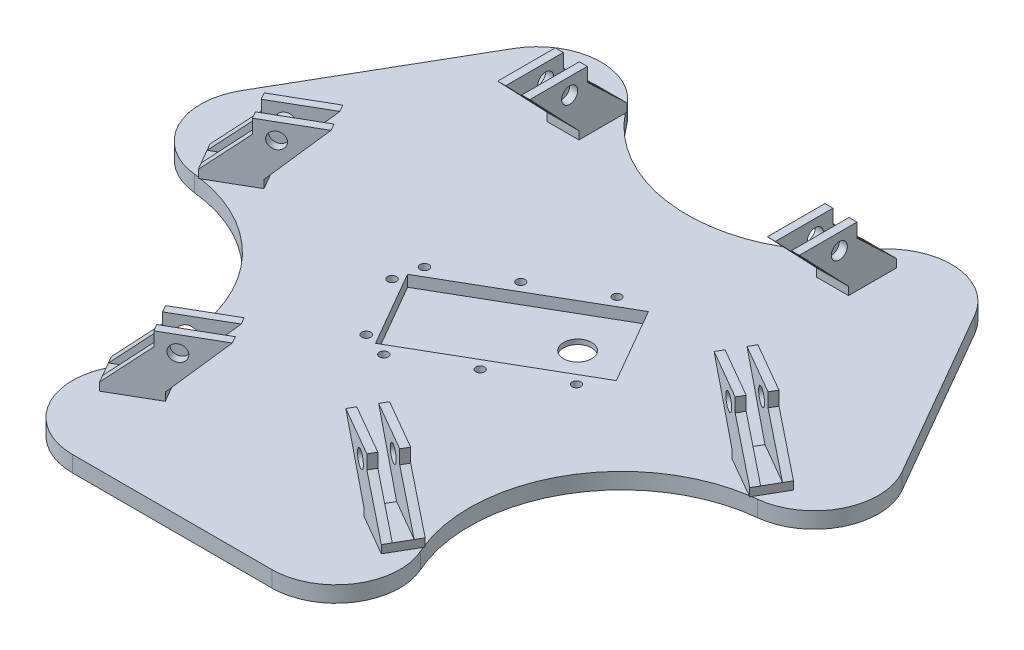
from build123d import *

# Parameters (mm, degrees)
BOSS_EXTRUDE1_DEPTH      = 5
BOSS_EXTRUDE11_DEPTH     = 2.5
BOSS_EXTRUDE12_DEPTH     = 2.5
SKETCH29_R               = 2.5
CUT_EXTRUDE1_DEPTH       = 204.243080392
MIRROR5_COPY_1_DEPTH     = 2.5
MIRROR5_COPY_2_SKETCH_R  = 2.5
MIRROR5_COPY_2_DEPTH     = 204.243080392
MIRROR6_COPY_1_DEPTH     = 2.5
MIRROR6_COPY_2_SKETCH_R  = 2.5
MIRROR6_COPY_2_DEPTH     = 204.243080392
MIRROR6_COPY_3_SKETCH_R  = 2.5
MIRROR6_COPY_3_DEPTH     = 204.243080392
MIRROR6_COPY_4_DEPTH     = 2.5
MIRROR6_COPY_5_DEPTH     = 2.5
MIRROR6_COPY_6_SKETCH_R  = 2.5
MIRROR6_COPY_6_DEPTH     = 204.243080392
MIRROR6_COPY_7_DEPTH     = 2.5
MIRROR6_COPY_8_SKETCH_R  = 2.5
MIRROR6_COPY_8_DEPTH     = 204.243080392
MIRROR6_COPY_9_SKETCH_R  = 2.5
MIRROR6_COPY_9_DEPTH     = 204.243080392
MIRROR7_COPY_1_DEPTH     = 2.5
MIRROR7_COPY_2_SKETCH_R  = 2.5
MIRROR7_COPY_2_DEPTH     = 204.243080392
MIRROR7_COPY_3_DEPTH     = 2.5
MIRROR7_COPY_4_SKETCH_R  = 2.5
MIRROR7_COPY_4_DEPTH     = 204.243080392
MIRROR7_COPY_5_DEPTH     = 2.5
MIRROR7_COPY_6_DEPTH     = 2.5
MIRROR7_COPY_7_SKETCH_R  = 2.5
MIRROR7_COPY_7_DEPTH     = 204.243080392
MIRROR7_COPY_8_DEPTH     = 2.5
MIRROR7_COPY_9_SKETCH_R  = 2.5
MIRROR7_COPY_9_DEPTH     = 204.243080392
MIRROR7_COPY_10_DEPTH    = 2.5
MIRROR7_COPY_11_DEPTH    = 2.5
MIRROR7_COPY_12_SKETCH_R = 2.5
MIRROR7_COPY_12_DEPTH    = 204.243080392
MIRROR7_COPY_13_DEPTH    = 2.5
MIRROR7_COPY_14_DEPTH    = 2.5
MIRROR7_COPY_15_DEPTH    = 2.5
MIRROR7_COPY_16_SKETCH_R = 2.5
MIRROR7_COPY_16_DEPTH    = 204.243080392
MIRROR7_COPY_17_SKETCH_R = 2.5
MIRROR7_COPY_17_DEPTH    = 204.243080392
MIRROR7_COPY_18_DEPTH    = 2.5
MIRROR7_COPY_19_DEPTH    = 2.5
MIRROR7_COPY_20_SKETCH_R = 2.5
MIRROR7_COPY_20_DEPTH    = 204.243080392
MIRROR7_COPY_21_DEPTH    = 2.5
MIRROR7_COPY_22_SKETCH_R = 2.5
MIRROR7_COPY_22_DEPTH    = 204.243080392
MIRROR7_COPY_23_SKETCH_R = 2.5
MIRROR7_COPY_23_DEPTH    = 204.243080392
MIRROR7_COPY_24_DEPTH    = 2.5
MIRROR7_COPY_25_DEPTH    = 2.5
MIRROR7_COPY_26_SKETCH_R = 2.5
MIRROR7_COPY_26_DEPTH    = 204.243080392
CUT_EXTRUDE2_DEPTH       = 3.5
SKETCH31_R               = 4.4
CUT_EXTRUDE3_DEPTH       = 218.222961533
SKETCH33_R               = 1.35
SKETCH33_R_2             = 1.385
CUT_EXTRUDE4_DEPTH       = 217.895493722


with BuildPart() as part:
    # Sketch1 → Boss-Extrude1 (new body)
    with BuildSketch(Plane(origin=(0, 0, 0), x_dir=(1, 0, 0), z_dir=(0, 1, 0))):
        with BuildLine():
            Line((-71.958276695, 178.473500064), (-103.041723305, 124.63539126))
            ThreePointArc((-103.041723305, 124.63539126), (-103.538010574, 105.549038655), (-87.797177129, 94.743423479))
            ThreePointArc((-87.797177129, 94.743423479), (-51.591379961, 71.25), (-49.34837699, 28.148148148))
            ThreePointArc((-49.34837699, 28.148148148), (-47.860856467, 9.113378921), (-31.083446611, 0))
            Line((-31.083446611, 0), (31.083446611, 0))
            ThreePointArc((31.083446611, 0), (47.860856467, 9.113378921), (49.34837699, 28.148148148))
            ThreePointArc((49.34837699, 28.148148148), (51.591379961, 71.25), (87.797177129, 94.743423479))
            ThreePointArc((87.797177129, 94.743423479), (103.538010574, 105.549038655), (103.041723305, 124.63539126))
            Line((103.041723305, 124.63539126), (71.958276695, 178.473500064))
            ThreePointArc((71.958276695, 178.473500064), (55.677154107, 188.446473749), (38.448800139, 180.217319697))
            ThreePointArc((38.448800139, 180.217319697), (0, 160.608891325), (-38.448800139, 180.217319697))
            ThreePointArc((-38.448800139, 180.217319697), (-55.677154107, 188.446473749), (-71.958276695, 178.473500064))
        make_face()
    extrude(amount=BOSS_EXTRUDE1_DEPTH)

    # Sketch27 → Boss-Extrude11 (add)
    with BuildSketch(Plane(origin=(0, 5, 0), x_dir=(1, 0, 0), z_dir=(0, 1, 0))):
        Polygon((-91.006862425, 102.829137181), (-86.006862425, 94.168883143), (-73.016481368, 101.668883143), (-78.016481368, 110.329137181), align=None)
    boss_extrude11 = extrude(amount=BOSS_EXTRUDE11_DEPTH)

    # Sketch28 → Boss-Extrude12 (add)
    with BuildSketch(Plane(origin=(-62.27803813, 0, -107.868726237), x_dir=(0.8660254037844392, 0, -0.4999999999999992), z_dir=(0.4999999999999992, 0, 0.8660254037844392))):
        Polygon((-27.399686188, 7.5), (-15.026700929, 19.217361527), (-15.026700929, 23.558545761), (2.927379132, 23.558545761), (-12.399686188, 7.5), align=None)
    boss_extrude12 = extrude(amount=-BOSS_EXTRUDE12_DEPTH)

    # Sketch29 → Cut-Extrude1 (cut, symmetric)
    with BuildSketch(Plane(origin=(-63.52803813, 0, -110.033789746), x_dir=(-0.8660254037844393, 0, 0.49999999999999895), z_dir=(-0.49999999999999895, 0, -0.8660254037844393))):
        with Locations((9.526700929, 18.558545761)):
            Circle(SKETCH29_R)
    cut_extrude1 = extrude(amount=CUT_EXTRUDE1_DEPTH, both=True, mode=Mode.SUBTRACT)

    # Mirror4: Boss-Extrude12, Cut-Extrude1 across plane
    add(boss_extrude12.mirror(Plane(origin=(-64.77803813, 0, -112.198853256), x_dir=(-0.8660254037844388, 0, 0.49999999999999967), z_dir=(0.49999999999999967, 0, 0.8660254037844388))))
    add(cut_extrude1.mirror(Plane(origin=(-64.77803813, 0, -112.198853256), x_dir=(-0.8660254037844388, 0, 0.49999999999999967), z_dir=(0.49999999999999967, 0, 0.8660254037844388))), mode=Mode.SUBTRACT)

    # Mirror5: Boss-Extrude11, Boss-Extrude12, Cut-Extrude1 across plane
    add(boss_extrude11.mirror(Plane(origin=(-43.75, 0, -75.777222831), x_dir=(-0.8660254037844389, 0, 0.4999999999999998), z_dir=(0.5000000000000001, 0, 0.8660254037844387))))
    add(boss_extrude12.mirror(Plane(origin=(-43.75, 0, -75.777222831), x_dir=(-0.8660254037844389, 0, 0.4999999999999998), z_dir=(0.5000000000000001, 0, 0.8660254037844387))))
    add(cut_extrude1.mirror(Plane(origin=(-43.75, 0, -75.777222831), x_dir=(-0.8660254037844389, 0, 0.4999999999999998), z_dir=(0.5000000000000001, 0, 0.8660254037844387))), mode=Mode.SUBTRACT)

    # Mirror5 copy 1 sketch → Mirror5 copy 1 (add)
    with BuildSketch(Plane(origin=(-20.22196187, 0, -35.025465388), x_dir=(0.8660254037844386, 0, -0.5000000000000001), z_dir=(0.5000000000000001, 0, 0.8660254037844392))):
        Polygon((-27.399686188, 7.5), (-15.026700929, 19.217361527), (-15.026700929, 23.558545761), (2.927379132, 23.558545761), (-12.399686188, 7.5), align=None)
    extrude(amount=-MIRROR5_COPY_1_DEPTH)

    # Mirror5 copy 2 sketch → Mirror5 copy 2 (cut, symmetric)
    with BuildSketch(Plane(origin=(-21.47196187, 0, -37.190528897), x_dir=(-0.8660254037844387, 0, 0.4999999999999998), z_dir=(-0.49999999999999983, 0, -0.8660254037844393))):
        with Locations((9.526700929, 18.558545761)):
            Circle(MIRROR5_COPY_2_SKETCH_R)
    extrude(amount=MIRROR5_COPY_2_DEPTH, both=True, mode=Mode.SUBTRACT)

    # Mirror6: Boss-Extrude11, Boss-Extrude12 across plane
    add(boss_extrude11.mirror(Plane(origin=(0, 0, 0), x_dir=(0, 0, 1), z_dir=(1, 0, 0))))
    add(boss_extrude12.mirror(Plane(origin=(0, 0, 0), x_dir=(0, 0, 1), z_dir=(1, 0, 0))))

    # Mirror6 copy 1 sketch → Mirror6 copy 1 (add)
    with BuildSketch(Plane(origin=(67.27803813, 0, -116.528980275), x_dir=(-0.8660254037844386, 0, -0.5000000000000002), z_dir=(0.5000000000000002, 0, -0.8660254037844386))):
        Polygon((-27.399686188, 7.5), (-15.026700929, 19.217361527), (-15.026700929, 23.558545761), (2.927379132, 23.558545761), (-12.399686188, 7.5), align=None)
    extrude(amount=-MIRROR6_COPY_1_DEPTH)

    # Mirror6 copy 2 sketch → Mirror6 copy 2 (cut, symmetric)
    with BuildSketch(Plane(origin=(66.02803813, 0, -114.363916765), x_dir=(0.8660254037844384, 0, 0.5000000000000004), z_dir=(-0.5000000000000004, 0, 0.8660254037844384))):
        with Locations((9.526700929, 18.558545761)):
            Circle(MIRROR6_COPY_2_SKETCH_R)
    extrude(amount=MIRROR6_COPY_2_DEPTH, both=True, mode=Mode.SUBTRACT)

    # Mirror6 copy 3 sketch → Mirror6 copy 3 (cut, symmetric)
    with BuildSketch(Plane(origin=(63.52803813, 0, -110.033789746), x_dir=(0.8660254037844393, 0, 0.49999999999999895), z_dir=(0.49999999999999895, 0, -0.8660254037844393))):
        with Locations((9.526700929, -18.558545761)):
            Circle(MIRROR6_COPY_3_SKETCH_R)
    extrude(amount=MIRROR6_COPY_3_DEPTH, both=True, mode=Mode.SUBTRACT)

    # Mirror6 copy 4 sketch → Mirror6 copy 4 (add)
    with BuildSketch(Plane(origin=(87.5, 5, -151.554445662), x_dir=(-0.4999999999999998, 0, -0.8660254037844389), z_dir=(0, 1, 0))):
        Polygon((-91.006862425, 102.829137181), (-86.006862425, 94.168883143), (-73.016481368, 101.668883143), (-78.016481368, 110.329137181), align=None)
    extrude(amount=MIRROR6_COPY_4_DEPTH)

    # Mirror6 copy 5 sketch → Mirror6 copy 5 (add)
    with BuildSketch(Plane(origin=(25.22196187, 0, -43.685719425), x_dir=(-0.8660254037844382, 0, -0.5000000000000009), z_dir=(0.5000000000000011, 0, -0.8660254037844386))):
        Polygon((-27.399686188, 7.5), (-15.026700929, 19.217361527), (-15.026700929, 23.558545761), (2.927379132, 23.558545761), (-12.399686188, 7.5), align=None)
    extrude(amount=-MIRROR6_COPY_5_DEPTH)

    # Mirror6 copy 6 sketch → Mirror6 copy 6 (cut, symmetric)
    with BuildSketch(Plane(origin=(23.97196187, 0, -41.520655916), x_dir=(0.866025403784438, 0, 0.5000000000000012), z_dir=(-0.5000000000000014, 0, 0.8660254037844384))):
        with Locations((9.526700929, 18.558545761)):
            Circle(MIRROR6_COPY_6_SKETCH_R)
    extrude(amount=MIRROR6_COPY_6_DEPTH, both=True, mode=Mode.SUBTRACT)

    # Mirror6 copy 7 sketch → Mirror6 copy 7 (add)
    with BuildSketch(Plane(origin=(20.22196187, 0, -35.025465388), x_dir=(-0.8660254037844386, 0, -0.5000000000000001), z_dir=(-0.5000000000000001, 0, 0.8660254037844392))):
        Polygon((-27.399686188, -7.5), (-15.026700929, -19.217361527), (-15.026700929, -23.558545761), (2.927379132, -23.558545761), (-12.399686188, -7.5), align=None)
    extrude(amount=-MIRROR6_COPY_7_DEPTH)

    # Mirror6 copy 8 sketch → Mirror6 copy 8 (cut, symmetric)
    with BuildSketch(Plane(origin=(21.47196187, 0, -37.190528897), x_dir=(0.8660254037844387, 0, 0.4999999999999998), z_dir=(0.49999999999999983, 0, -0.8660254037844393))):
        with Locations((9.526700929, -18.558545761)):
            Circle(MIRROR6_COPY_8_SKETCH_R)
    extrude(amount=MIRROR6_COPY_8_DEPTH, both=True, mode=Mode.SUBTRACT)

    # Mirror6 copy 9 sketch → Mirror6 copy 9 (cut, symmetric)
    with BuildSketch(Plane(origin=(63.52803813, 0, -110.033789746), x_dir=(0.8660254037844393, 0, 0.49999999999999895), z_dir=(0.49999999999999895, 0, -0.8660254037844393))):
        with Locations((9.526700929, -18.558545761)):
            Circle(MIRROR6_COPY_9_SKETCH_R)
    extrude(amount=MIRROR6_COPY_9_DEPTH, both=True, mode=Mode.SUBTRACT)

    # Mirror7 copy 1 sketch → Mirror7 copy 1 (add)
    with BuildSketch(Plane(origin=(-20.22196187, 0, -35.025465388), x_dir=(0.8660254037844386, 0, -0.5000000000000001), z_dir=(0.5000000000000001, 0, 0.8660254037844392))):
        Polygon((-27.399686188, 7.5), (-15.026700929, 19.217361527), (-15.026700929, 23.558545761), (2.927379132, 23.558545761), (-12.399686188, 7.5), align=None)
    extrude(amount=-MIRROR7_COPY_1_DEPTH)

    # Mirror7 copy 2 sketch → Mirror7 copy 2 (cut, symmetric)
    with BuildSketch(Plane(origin=(-21.47196187, 0, -37.190528897), x_dir=(-0.8660254037844387, 0, 0.4999999999999998), z_dir=(-0.49999999999999983, 0, -0.8660254037844393))):
        with Locations((9.526700929, 18.558545761)):
            Circle(MIRROR7_COPY_2_SKETCH_R)
    extrude(amount=MIRROR7_COPY_2_DEPTH, both=True, mode=Mode.SUBTRACT)

    # Mirror7 copy 3 sketch → Mirror7 copy 3 (add)
    with BuildSketch(Plane(origin=(-25.22196187, 0, -43.685719425), x_dir=(0.8660254037844382, 0, -0.5000000000000009), z_dir=(-0.5000000000000011, 0, -0.8660254037844386))):
        Polygon((-27.399686188, -7.5), (-15.026700929, -19.217361527), (-15.026700929, -23.558545761), (2.927379132, -23.558545761), (-12.399686188, -7.5), align=None)
    extrude(amount=-MIRROR7_COPY_3_DEPTH)

    # Mirror7 copy 4 sketch → Mirror7 copy 4 (cut, symmetric)
    with BuildSketch(Plane(origin=(-23.97196187, 0, -41.520655916), x_dir=(-0.866025403784438, 0, 0.5000000000000012), z_dir=(0.5000000000000014, 0, 0.8660254037844384))):
        with Locations((9.526700929, -18.558545761)):
            Circle(MIRROR7_COPY_4_SKETCH_R)
    extrude(amount=MIRROR7_COPY_4_DEPTH, both=True, mode=Mode.SUBTRACT)

    # Mirror7 copy 5 sketch → Mirror7 copy 5 (add)
    with BuildSketch(Plane(origin=(0, 5, 0), x_dir=(1, 0, 0), z_dir=(0, 1, 0))):
        Polygon((-91.006862425, 102.829137181), (-86.006862425, 94.168883143), (-73.016481368, 101.668883143), (-78.016481368, 110.329137181), align=None)
    extrude(amount=MIRROR7_COPY_5_DEPTH)

    # Mirror7 copy 6 sketch → Mirror7 copy 6 (add)
    with BuildSketch(Plane(origin=(-62.27803813, 0, -107.868726237), x_dir=(0.8660254037844393, 0, -0.4999999999999993), z_dir=(0.4999999999999996, 0, 0.8660254037844398))):
        Polygon((-27.399686188, 7.5), (-15.026700929, 19.217361527), (-15.026700929, 23.558545761), (2.927379132, 23.558545761), (-12.399686188, 7.5), align=None)
    extrude(amount=-MIRROR7_COPY_6_DEPTH)

    # Mirror7 copy 7 sketch → Mirror7 copy 7 (cut, symmetric)
    with BuildSketch(Plane(origin=(-63.52803813, 0, -110.033789746), x_dir=(-0.8660254037844394, 0, 0.499999999999999), z_dir=(-0.49999999999999933, 0, -0.8660254037844399))):
        with Locations((9.526700929, 18.558545761)):
            Circle(MIRROR7_COPY_7_SKETCH_R)
    extrude(amount=MIRROR7_COPY_7_DEPTH, both=True, mode=Mode.SUBTRACT)

    # Mirror7 copy 8 sketch → Mirror7 copy 8 (add)
    with BuildSketch(Plane(origin=(-67.27803813, 0, -116.528980275), x_dir=(0.8660254037844386, 0, -0.5000000000000002), z_dir=(-0.5000000000000007, 0, -0.8660254037844394))):
        Polygon((-27.399686188, -7.5), (-15.026700929, -19.217361527), (-15.026700929, -23.558545761), (2.927379132, -23.558545761), (-12.399686188, -7.5), align=None)
    extrude(amount=-MIRROR7_COPY_8_DEPTH)

    # Mirror7 copy 9 sketch → Mirror7 copy 9 (cut, symmetric)
    with BuildSketch(Plane(origin=(-66.02803813, 0, -114.363916765), x_dir=(-0.8660254037844385, 0, 0.5000000000000003), z_dir=(0.5000000000000009, 0, 0.8660254037844393))):
        with Locations((9.526700929, -18.558545761)):
            Circle(MIRROR7_COPY_9_SKETCH_R)
    extrude(amount=MIRROR7_COPY_9_DEPTH, both=True, mode=Mode.SUBTRACT)

    # Mirror7 copy 10 sketch → Mirror7 copy 10 (add)
    with BuildSketch(Plane(origin=(-87.5, 5, -151.554445662), x_dir=(0.4999999999999998, 0, -0.8660254037844389), z_dir=(0, 1, 0))):
        Polygon((-91.006862425, -102.829137181), (-86.006862425, -94.168883143), (-73.016481368, -101.668883143), (-78.016481368, -110.329137181), align=None)
    extrude(amount=MIRROR7_COPY_10_DEPTH)

    # Mirror7 copy 11 sketch → Mirror7 copy 11 (add)
    with BuildSketch(Plane(origin=(-25.22196187, 0, -43.685719425), x_dir=(0.8660254037844382, 0, -0.5000000000000009), z_dir=(-0.5000000000000011, 0, -0.8660254037844386))):
        Polygon((-27.399686188, -7.5), (-15.026700929, -19.217361527), (-15.026700929, -23.558545761), (2.927379132, -23.558545761), (-12.399686188, -7.5), align=None)
    extrude(amount=-MIRROR7_COPY_11_DEPTH)

    # Mirror7 copy 12 sketch → Mirror7 copy 12 (cut, symmetric)
    with BuildSketch(Plane(origin=(-23.97196187, 0, -41.520655916), x_dir=(-0.866025403784438, 0, 0.5000000000000012), z_dir=(0.5000000000000014, 0, 0.8660254037844384))):
        with Locations((9.526700929, -18.558545761)):
            Circle(MIRROR7_COPY_12_SKETCH_R)
    extrude(amount=MIRROR7_COPY_12_DEPTH, both=True, mode=Mode.SUBTRACT)

    # Mirror7 copy 13 sketch → Mirror7 copy 13 (add)
    with BuildSketch(Plane(origin=(-87.5, 5, -151.554445662), x_dir=(-0.4999999999999998, 0, 0.8660254037844389), z_dir=(0, 1, 0))):
        Polygon((-91.006862425, 102.829137181), (-86.006862425, 94.168883143), (-73.016481368, 101.668883143), (-78.016481368, 110.329137181), align=None)
    extrude(amount=MIRROR7_COPY_13_DEPTH)

    # Mirror7 copy 14 sketch → Mirror7 copy 14 (add)
    with BuildSketch(Plane(origin=(37.05607626, 0, -151.554445662), x_dir=(0, 0, 1), z_dir=(-1, 0, 0))):
        Polygon((-27.399686188, 7.5), (-15.026700929, 19.217361527), (-15.026700929, 23.558545761), (2.927379132, 23.558545761), (-12.399686188, 7.5), align=None)
    extrude(amount=-MIRROR7_COPY_14_DEPTH)

    # Mirror7 copy 15 sketch → Mirror7 copy 15 (add)
    with BuildSketch(Plane(origin=(47.05607626, 0, -151.554445662), x_dir=(0, 0, 1), z_dir=(1, 0, 0))):
        Polygon((-27.399686188, -7.5), (-15.026700929, -19.217361527), (-15.026700929, -23.558545761), (2.927379132, -23.558545761), (-12.399686188, -7.5), align=None)
    extrude(amount=-MIRROR7_COPY_15_DEPTH)

    # Mirror7 copy 16 sketch → Mirror7 copy 16 (cut, symmetric)
    with BuildSketch(Plane(origin=(44.55607626, 0, -151.554445662), x_dir=(0, 0, -1), z_dir=(-1, 0, 0))):
        with Locations((9.526700929, -18.558545761)):
            Circle(MIRROR7_COPY_16_SKETCH_R)
    extrude(amount=MIRROR7_COPY_16_DEPTH, both=True, mode=Mode.SUBTRACT)

    # Mirror7 copy 17 sketch → Mirror7 copy 17 (cut, symmetric)
    with BuildSketch(Plane(origin=(39.55607626, 0, -151.554445662), x_dir=(0, 0, -1), z_dir=(1, 0, 0))):
        with Locations((9.526700929, 18.558545761)):
            Circle(MIRROR7_COPY_17_SKETCH_R)
    extrude(amount=MIRROR7_COPY_17_DEPTH, both=True, mode=Mode.SUBTRACT)

    # Mirror7 copy 18 sketch → Mirror7 copy 18 (add)
    with BuildSketch(Plane(origin=(87.5, 5, -151.554445662), x_dir=(0.5000000000000007, 0, 0.8660254037844389), z_dir=(0, 1, 0))):
        Polygon((-91.006862425, -102.829137181), (-86.006862425, -94.168883143), (-73.016481368, -101.668883143), (-78.016481368, -110.329137181), align=None)
    extrude(amount=MIRROR7_COPY_18_DEPTH)

    # Mirror7 copy 19 sketch → Mirror7 copy 19 (add)
    with BuildSketch(Plane(origin=(-37.05607626, 0, -151.554445662), x_dir=(0, 0, 1), z_dir=(1, 0, 0))):
        Polygon((-27.399686188, -7.5), (-15.026700929, -19.217361527), (-15.026700929, -23.558545761), (2.927379132, -23.558545761), (-12.399686188, -7.5), align=None)
    extrude(amount=-MIRROR7_COPY_19_DEPTH)

    # Mirror7 copy 20 sketch → Mirror7 copy 20 (cut, symmetric)
    with BuildSketch(Plane(origin=(-39.55607626, 0, -151.554445662), x_dir=(0, 0, -1), z_dir=(-1, 0, 0))):
        with Locations((9.526700929, -18.558545761)):
            Circle(MIRROR7_COPY_20_SKETCH_R)
    extrude(amount=MIRROR7_COPY_20_DEPTH, both=True, mode=Mode.SUBTRACT)

    # Mirror7 copy 21 sketch → Mirror7 copy 21 (add)
    with BuildSketch(Plane(origin=(-47.05607626, 0, -151.554445662), x_dir=(0, 0, 1), z_dir=(-1, 0, 0))):
        Polygon((-27.399686188, 7.5), (-15.026700929, 19.217361527), (-15.026700929, 23.558545761), (2.927379132, 23.558545761), (-12.399686188, 7.5), align=None)
    extrude(amount=-MIRROR7_COPY_21_DEPTH)

    # Mirror7 copy 22 sketch → Mirror7 copy 22 (cut, symmetric)
    with BuildSketch(Plane(origin=(-44.55607626, 0, -151.554445662), x_dir=(0, 0, -1), z_dir=(1, 0, 0))):
        with Locations((9.526700929, 18.558545761)):
            Circle(MIRROR7_COPY_22_SKETCH_R)
    extrude(amount=MIRROR7_COPY_22_DEPTH, both=True, mode=Mode.SUBTRACT)

    # Mirror7 copy 23 sketch → Mirror7 copy 23 (cut, symmetric)
    with BuildSketch(Plane(origin=(39.55607626, 0, -151.554445662), x_dir=(0, 0, -1), z_dir=(1, 0, 0))):
        with Locations((9.526700929, 18.558545761)):
            Circle(MIRROR7_COPY_23_SKETCH_R)
    extrude(amount=MIRROR7_COPY_23_DEPTH, both=True, mode=Mode.SUBTRACT)

    # Mirror7 copy 24 sketch → Mirror7 copy 24 (add)
    with BuildSketch(Plane(origin=(-87.5, 5, -151.554445662), x_dir=(0.4999999999999998, 0, -0.8660254037844389), z_dir=(0, 1, 0))):
        Polygon((-91.006862425, -102.829137181), (-86.006862425, -94.168883143), (-73.016481368, -101.668883143), (-78.016481368, -110.329137181), align=None)
    extrude(amount=MIRROR7_COPY_24_DEPTH)

    # Mirror7 copy 25 sketch → Mirror7 copy 25 (add)
    with BuildSketch(Plane(origin=(-25.22196187, 0, -43.685719425), x_dir=(0.8660254037844382, 0, -0.5000000000000009), z_dir=(-0.5000000000000011, 0, -0.8660254037844386))):
        Polygon((-27.399686188, -7.5), (-15.026700929, -19.217361527), (-15.026700929, -23.558545761), (2.927379132, -23.558545761), (-12.399686188, -7.5), align=None)
    extrude(amount=-MIRROR7_COPY_25_DEPTH)

    # Mirror7 copy 26 sketch → Mirror7 copy 26 (cut, symmetric)
    with BuildSketch(Plane(origin=(-23.97196187, 0, -41.520655916), x_dir=(-0.866025403784438, 0, 0.5000000000000012), z_dir=(0.5000000000000014, 0, 0.8660254037844384))):
        with Locations((9.526700929, -18.558545761)):
            Circle(MIRROR7_COPY_26_SKETCH_R)
    extrude(amount=MIRROR7_COPY_26_DEPTH, both=True, mode=Mode.SUBTRACT)

    # Sketch30 → Cut-Extrude2 (cut)
    with BuildSketch(Plane(origin=(0, 5, 0), x_dir=(1, 0, 0), z_dir=(0, 1, 0))):
        Polygon((20.140299429, 128.427300434), (33.791454429, 104.78280639), (-13.840995432, 77.28219864), (-27.492150433, 100.926692684), align=None)
    extrude(amount=-CUT_EXTRUDE2_DEPTH, mode=Mode.SUBTRACT)

    # Sketch31 → Cut-Extrude3 (cut, through all)
    with BuildSketch(Plane(origin=(0, 1.5, 0), x_dir=(1, 0, 0), z_dir=(0, 1, 0))):
        with Locations(Location((16.140559382, 110.355053412, 0), (0, 0, 90))):
            Circle(SKETCH31_R)
    extrude(amount=-CUT_EXTRUDE3_DEPTH, mode=Mode.SUBTRACT)

    # Sketch33 → Cut-Extrude4 (cut, through all)
    with BuildSketch(Plane(origin=(0, 5, 0), x_dir=(1, 0, 0), z_dir=(0, 1, 0))):
        with Locations(Location((11.286566851, 127.519984095, 0), (0, 0, 90))):
            Circle(SKETCH33_R)
        with Locations(Location((-7.765992032, 116.519984095, 0), (0, 0, 90))):
            Circle(SKETCH33_R)
        with Locations(Location((-28.603843063, 97.214631801, 0), (0, 0, 90))):
            Circle(SKETCH33_R_2)
        with Locations(Location((-17.603843063, 78.162072918, 0), (0, 0, 90))):
            Circle(SKETCH33_R_2)
        with Locations(Location((-9.518550915, 75.555505124, 0), (0, 0, 90))):
            Circle(SKETCH33_R)
        with Locations(Location((9.534007968, 86.555505124, 0), (0, 0, 90))):
            Circle(SKETCH33_R)
        with Locations(Location((28.586566851, 97.555505124, 0), (0, 0, 90))):
            Circle(SKETCH33_R)
        with Locations(Location((-26.818550915, 105.519984095, 0), (0, 0, 90))):
            Circle(SKETCH33_R_2)
    extrude(amount=-CUT_EXTRUDE4_DEPTH, mode=Mode.SUBTRACT)


solid = part.part
